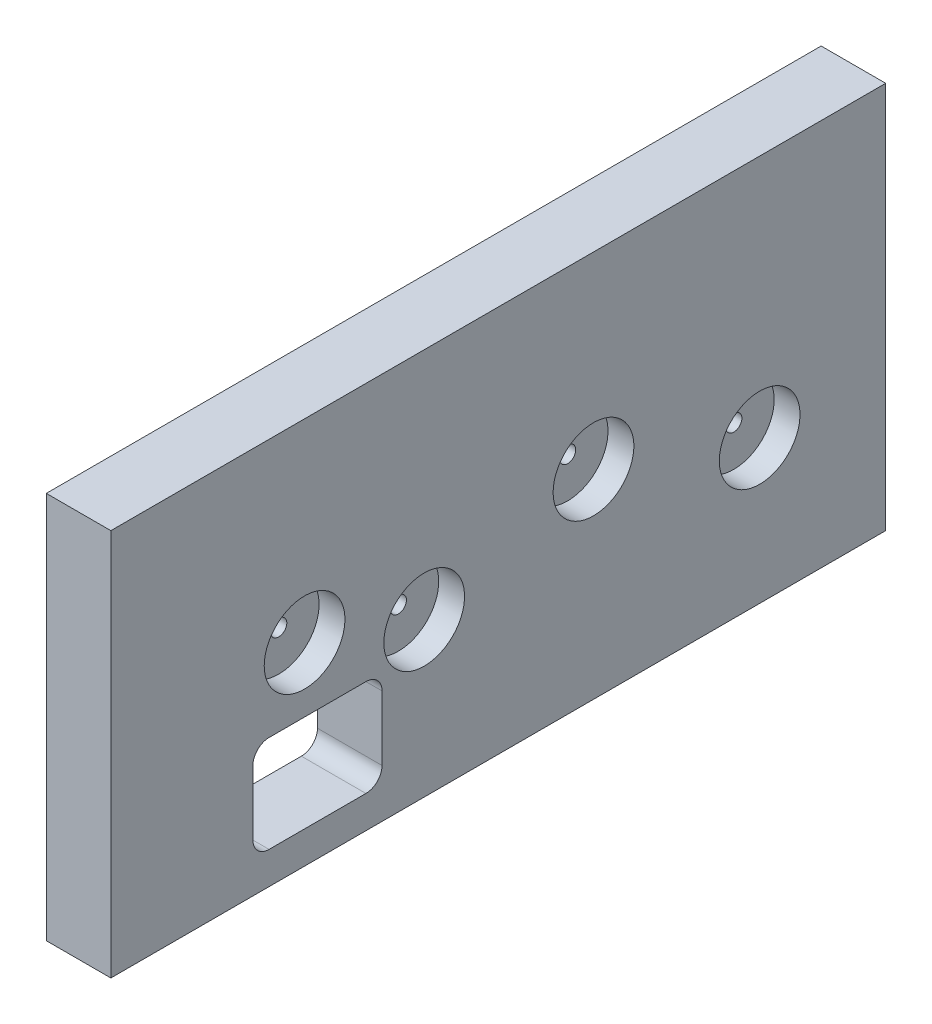
from build123d import *

# Parameters (mm, degrees)
SKETCH1_W                       = 152.4
SKETCH1_H                       = 76.2
SKETCH1_R                       = 1.5875
BOSS_EXTRUDE1_DEPTH             = 12.7
SKETCH2_R                       = 7.9375
CUT_EXTRUDE1_DEPTH              = 5.08
F_1_4_0_25_DIAMETER_HOLE1_D     = 6.35
F_1_4_0_25_DIAMETER_HOLE1_DEPTH = 38.1
F_1_4_0_25_DIAMETER_HOLE1_TIP   = 1.907732465
CUT_EXTRUDE2_DEPTH              = 25.4


with BuildPart() as part:
    # Sketch1 → Boss-Extrude1 (new body)
    with BuildSketch(Plane(origin=(0, 0, 0), x_dir=(0, 0, -1), z_dir=(1, 0, 0))):
        Rectangle(SKETCH1_W, SKETCH1_H)
        with Locations((18.72253158, 1.096077429)):
            Circle(SKETCH1_R, mode=Mode.SUBTRACT)
        with Locations((-38.1, 0)):
            Circle(SKETCH1_R, mode=Mode.SUBTRACT)
        with Locations((-14.571224015, -7.860160654)):
            Circle(SKETCH1_R, mode=Mode.SUBTRACT)
        with Locations((51.408255992, -9.873506971)):
            Circle(SKETCH1_R, mode=Mode.SUBTRACT)
    extrude(amount=BOSS_EXTRUDE1_DEPTH)

    # Sketch2 → Cut-Extrude1 (cut)
    with BuildSketch(Plane.ZY.offset(-12.7)):
        with Locations((38.1, 0)):
            Circle(SKETCH2_R)
        with Locations((14.571224015, -7.860160654)):
            Circle(SKETCH2_R)
        with Locations((-18.72253158, 1.096077429)):
            Circle(SKETCH2_R)
        with Locations((-51.408255992, -9.873506971)):
            Circle(SKETCH2_R)
    extrude(amount=CUT_EXTRUDE1_DEPTH, mode=Mode.SUBTRACT)

    # 1/4 (0.25) Diameter Hole1
    with Locations(Plane.XZ.offset(38.1)):
        with Locations((6.35, -63.5), (6.35, 0), (6.35, 57.15)):
            Hole(F_1_4_0_25_DIAMETER_HOLE1_D / 2, depth=F_1_4_0_25_DIAMETER_HOLE1_DEPTH)
            with Locations((0, 0, -(F_1_4_0_25_DIAMETER_HOLE1_DEPTH + F_1_4_0_25_DIAMETER_HOLE1_TIP / 2))):  # 118° drill point
                Cone(0, F_1_4_0_25_DIAMETER_HOLE1_D / 2, F_1_4_0_25_DIAMETER_HOLE1_TIP, mode=Mode.SUBTRACT)

    # Sketch5 → Cut-Extrude2 (cut)
    with BuildSketch(Plane(origin=(12.7, 0, 0), x_dir=(0, 0, -1), z_dir=(1, 0, 0))):
        with BuildLine():
            Line((-45.085, -12.7), (-26.035, -12.7))
            ThreePointArc((-26.035, -12.7), (-23.78993597, -13.62993597), (-22.86, -15.875))
            Line((-22.86, -15.875), (-22.86, -28.575))
            ThreePointArc((-22.86, -28.575), (-23.78993597, -30.82006403), (-26.035, -31.75))
            Line((-26.035, -31.75), (-45.085, -31.75))
            ThreePointArc((-45.085, -31.75), (-47.33006403, -30.82006403), (-48.26, -28.575))
            Line((-48.26, -28.575), (-48.26, -15.875))
            ThreePointArc((-48.26, -15.875), (-47.33006403, -13.62993597), (-45.085, -12.7))
        make_face()
    extrude(amount=-CUT_EXTRUDE2_DEPTH, mode=Mode.SUBTRACT)


solid = part.part
